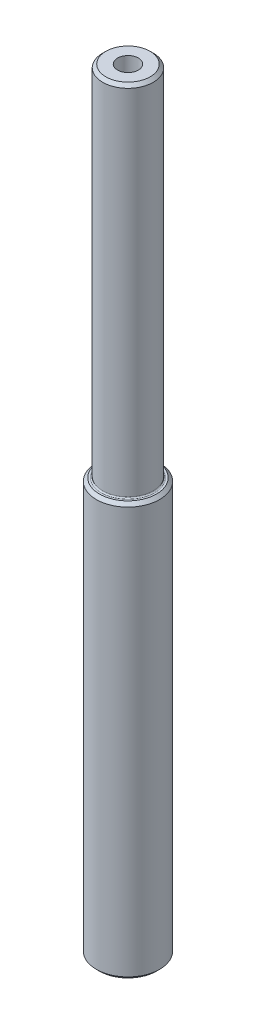
from build123d import *

# Parameters (mm, degrees)
FILLET1_R     = 0.2
CHAMFER1_SIZE = 0.5


with BuildPart() as part:
    # Sketch1 → Revolve1 (revolve)
    with BuildSketch(Plane.XY, mode=Mode.PRIVATE) as revolve1_sk:
        Polygon((0, 0), (5, 0), (5, 65.35), (4, 65.35), (4, 122), (0, 122), align=None)
    revolve(revolve1_sk.sketch.rotate(Axis((0, 7.476190476, 0), (0, -1, 0)), 90), axis=Axis((0, 7.476190476, 0), (0, -1, 0)))

    # Sketch4 → M4 Tapped Hole1 (revolve, cut)
    with BuildSketch(Plane(origin=(0, 0, 0), x_dir=(0, 0, -1), z_dir=(1, 0, 0))):
        Polygon((0, 0), (0, 12.991420021), (1.65, 12), (1.65, 0), align=None)
    m4_tapped_hole1 = revolve(axis=Axis((0, -6.35, 0), (0, 1, 0)), mode=Mode.SUBTRACT)

    # Mirror1: M4 Tapped Hole1 across plane
    add(m4_tapped_hole1.mirror(Plane(origin=(0, 61, 0), x_dir=(0, 0, 1), z_dir=(0, -1, 0))), mode=Mode.SUBTRACT)

    # Fillet1
    fillet1_edges = [part.edges().sort_by_distance(p)[0] for p in [
        (0, 65.35, -4),
    ]]
    fillet(fillet1_edges, radius=FILLET1_R)

    # Chamfer1
    chamfer1_edges = [part.edges().sort_by_distance(p)[0] for p in [
        (0, 122, -4),
        (0, 65.35, -5),
        (0, 0, -5),
    ]]
    chamfer(chamfer1_edges, length=CHAMFER1_SIZE)


solid = part.part
